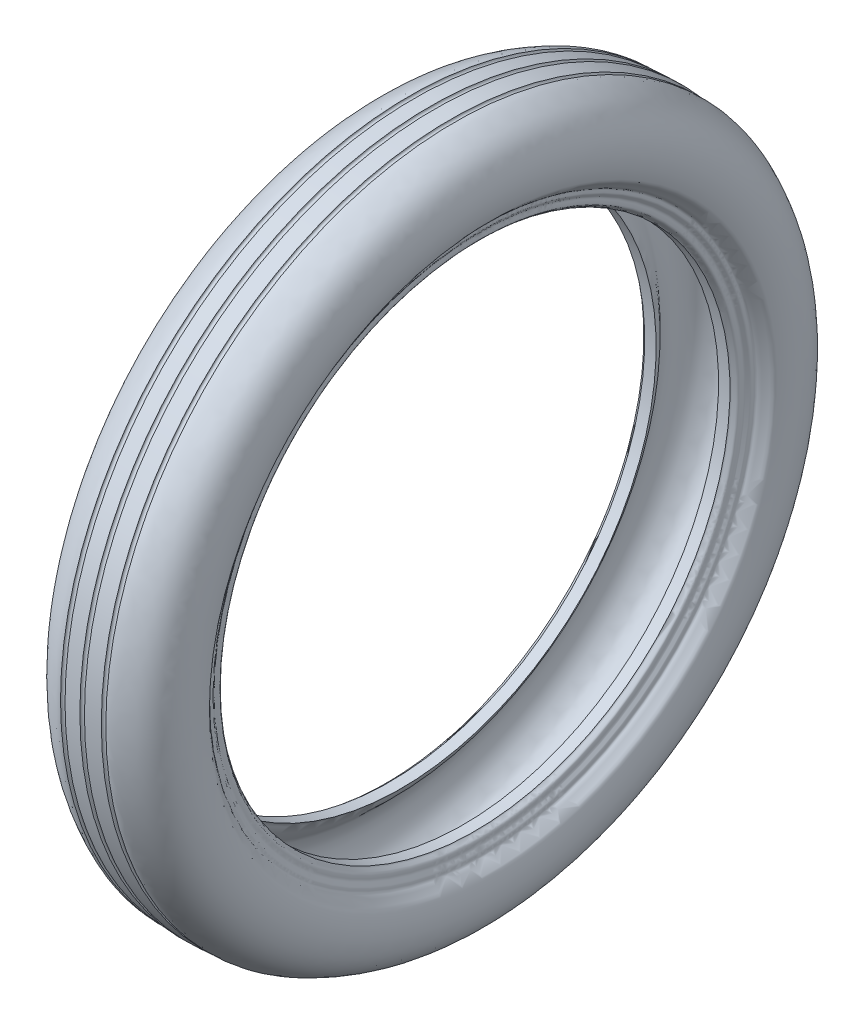
from build123d import *


with BuildPart() as part:
    # Sketch1 → Revolve2 (revolve)
    with BuildSketch(Plane.XY, mode=Mode.PRIVATE) as revolve2_sk:
        with BuildLine():
            Line((-24.817263014, 203), (-33.905274822, 203))
            add(Edge.make_bspline(
                [(-33.905274822, 203), (-34.451447712, 204.223315441), (-38.405176851, 205.210772848), (-37.589519666, 208.70245477), (-37.317673012, 211.637363166), (-40.367929344, 213.465220786), (-39.066067659, 217.086806756), (-42.529958862, 218.987124675), (-44.481203146, 222.024976144), (-48.1613249, 224.664233071), (-49.33731008, 231.297261903), (-50.56597037, 239.217588361), (-49.541908918, 249.30983287), (-46.425779413, 258.78583291), (-40.684911603, 266.454028141), (-33.868828279, 271.544671241), (-26.584866167, 275.239525499), (-21.384950053, 277.770418692), (-18.001254158, 277.496758701)],
                knots=[0, 0, 0, 0, 0.050284902, 0.080963925, 0.097205761, 0.139297033, 0.164562111, 0.19518801, 0.242420179, 0.280702553, 0.328072426, 0.440671497, 0.533149824, 0.638161135, 0.74644004, 0.823682365, 0.899584942, 1, 1, 1, 1], degree=3))
            ThreePointArc((-18.001254158, 277.496758701), (-16.21574569, 275.711250233), (-14.430237221, 277.496758701))
            Line((-14.430237221, 277.496758701), (-1.819058655, 278.30325082))
            ThreePointArc((-1.819058655, 278.30325082), (0, 276.484192165), (1.819058655, 278.30325082))
            Line((1.819058655, 278.30325082), (14.430237221, 277.496758701))
            ThreePointArc((14.430237221, 277.496758701), (16.21574569, 275.711250233), (18.001254158, 277.496758701))
            add(Edge.make_bspline(
                [(33.905274822, 203), (34.451447712, 204.223315441), (38.405176851, 205.210772848), (37.589519666, 208.70245477), (37.317673012, 211.637363166), (40.367929344, 213.465220786), (39.066067659, 217.086806756), (42.529958862, 218.987124675), (44.481203146, 222.024976144), (48.1613249, 224.664233071), (49.33731008, 231.297261903), (50.56597037, 239.217588361), (49.541908918, 249.30983287), (46.425779413, 258.78583291), (40.684911603, 266.454028141), (33.868828279, 271.544671241), (26.584866167, 275.239525499), (21.384950053, 277.770418692), (18.001254158, 277.496758701)],
                knots=[0, 0, 0, 0, 0.050284902, 0.080963925, 0.097205761, 0.139297033, 0.164562111, 0.19518801, 0.242420179, 0.280702553, 0.328072426, 0.440671497, 0.533149824, 0.638161135, 0.74644004, 0.823682365, 0.899584942, 1, 1, 1, 1], degree=3))
            Line((33.905274822, 203), (24.817263014, 203))
            add(Edge.make_bspline(
                [(24.817263014, 203), (27.228399829, 205.063914319), (28.549642734, 210.327625908), (33.671254535, 215.019378984), (37.777297666, 219.010363555), (42.263357726, 223.06202027), (45.167120419, 229.553937912), (48.02866542, 236.657792056), (47.887967472, 244.882513096), (46.394877316, 254.057111446), (40.348692935, 261.403587544), (33.851481322, 268.810867069), (25.244417526, 271.404992131), (16.742331219, 273.186419121), (10.140554755, 273.463220362), (4.544295124, 274.014061695), (1.753402076, 273.445280921), (0, 273.651830629)],
                knots=[0, 0, 0, 0, 0.082233062, 0.137617147, 0.183009303, 0.237253629, 0.297469874, 0.371716048, 0.44060469, 0.515818014, 0.616103803, 0.690267434, 0.776013818, 0.849380325, 0.924772593, 0.95299048, 1, 1, 1, 1], degree=3))
            add(Edge.make_bspline(
                [(-24.817263014, 203), (-27.228399829, 205.063914319), (-28.549642734, 210.327625908), (-33.671254535, 215.019378984), (-37.777297666, 219.010363555), (-42.263357726, 223.06202027), (-45.167120419, 229.553937912), (-48.02866542, 236.657792056), (-47.887967472, 244.882513096), (-46.394877316, 254.057111446), (-40.348692935, 261.403587544), (-33.851481322, 268.810867069), (-25.244417526, 271.404992131), (-16.742331219, 273.186419121), (-10.140554755, 273.463220362), (-4.544295124, 274.014061695), (-1.753402076, 273.445280921), (0, 273.651830629)],
                knots=[0, 0, 0, 0, 0.082233062, 0.137617147, 0.183009303, 0.237253629, 0.297469874, 0.371716048, 0.44060469, 0.515818014, 0.616103803, 0.690267434, 0.776013818, 0.849380325, 0.924772593, 0.95299048, 1, 1, 1, 1], degree=3))
        make_face()
    revolve(revolve2_sk.sketch.rotate(Axis((-102.722911075, 0, 0), (1, 0, 0)), 90), axis=Axis((-102.722911075, 0, 0), (1, 0, 0)))


solid = part.part
